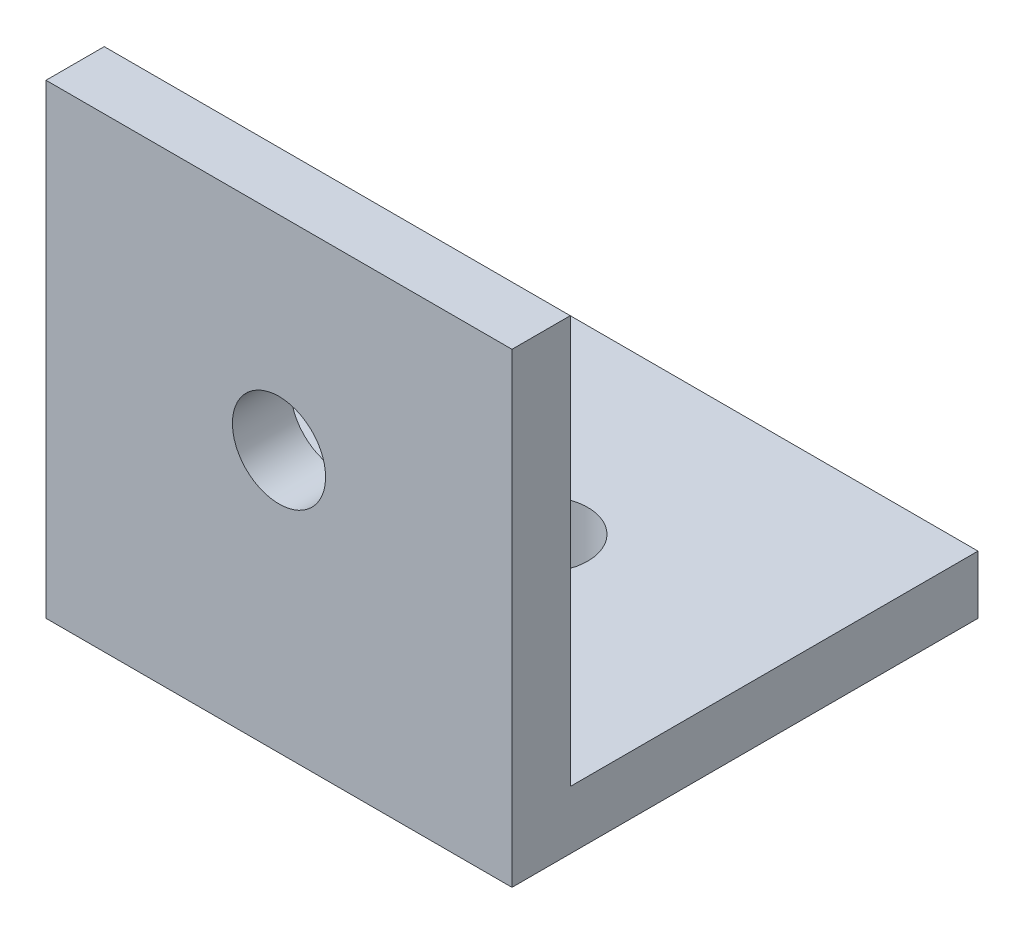
from build123d import *

# Parameters (mm, degrees)
BOSS_EXTRUDE1_DEPTH = 25.4
SKETCH2_R           = 2.54
CUT_EXTRUDE1_DEPTH  = 43.240627659
SKETCH3_R           = 2.54
CUT_EXTRUDE2_DEPTH  = 43.240627659


with BuildPart() as part:
    # Sketch1 → Boss-Extrude1 (new body)
    with BuildSketch(Plane(origin=(0, 0, 0), x_dir=(0, 0, -1), z_dir=(1, 0, 0))):
        Polygon((0, 0), (0, 25.4), (3.175, 25.4), (3.175, 3.175), (25.4, 3.175), (25.4, 0), align=None)
    extrude(amount=BOSS_EXTRUDE1_DEPTH)

    # Sketch2 → Cut-Extrude1 (cut, through all)
    with BuildSketch(Plane(origin=(0, 3.175, 0), x_dir=(1, 0, 0), z_dir=(0, 1, 0))):
        with Locations(Location((12.7, 14.2875, 0), (0, 0, 270))):
            Circle(SKETCH2_R)
    extrude(amount=-CUT_EXTRUDE1_DEPTH, mode=Mode.SUBTRACT)

    # Sketch3 → Cut-Extrude2 (cut, through all)
    with BuildSketch(Plane(origin=(0, 0, -3.175), x_dir=(-1, 0, 0), z_dir=(0, 0, -1))):
        with Locations(Location((-12.7, 14.2875, 0), (0, 0, 90))):
            Circle(SKETCH3_R)
    extrude(amount=-CUT_EXTRUDE2_DEPTH, mode=Mode.SUBTRACT)


solid = part.part
